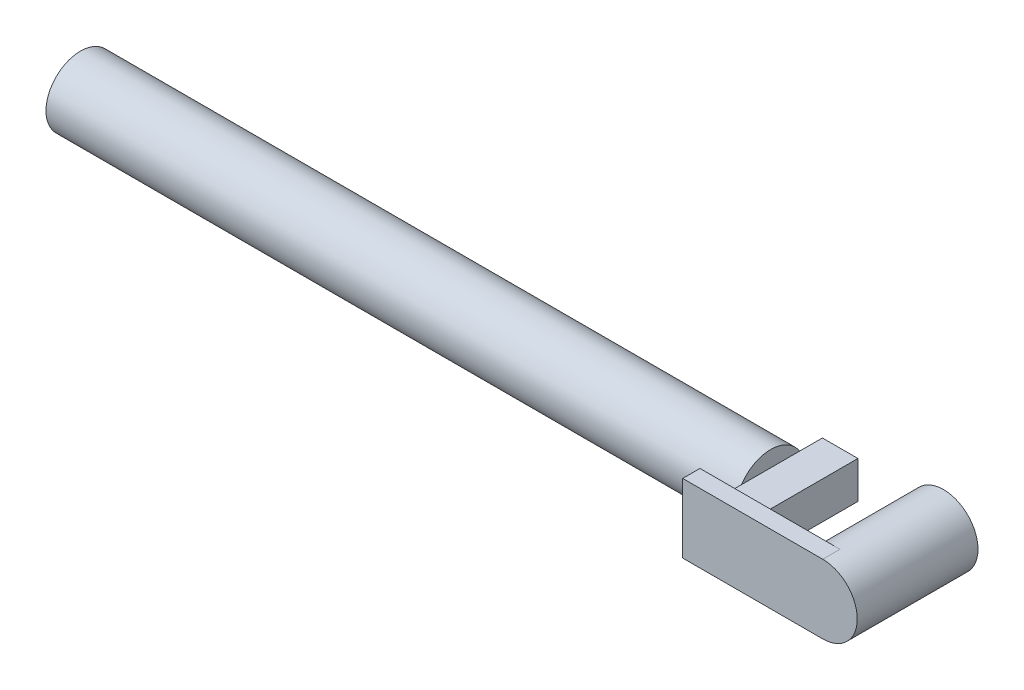
from build123d import *

# Parameters (mm, degrees)
SZKIC1_R                    = 10
DODANIE_WYCI_GNI_CIE1_DEPTH = 15
DODANIE_WYCI_GNI_CIE2_START = 5
DODANIE_WYCI_GNI_CIE2_DEPTH = 5
SZKIC3_W                    = 10.29571442
SZKIC3_H                    = 10.783406156
DODANIE_WYCI_GNI_CIE3_DEPTH = 30
SZKIC4_R                    = 10
DODANIE_WYCI_GNI_CIE4_DEPTH = 200


with BuildPart() as part:
    # Szkic1 → Dodanie-wyciągnięcie1 (new, symmetric)
    with BuildSketch(Plane.XY):
        Circle(SZKIC1_R)
    extrude(amount=DODANIE_WYCI_GNI_CIE1_DEPTH, both=True)

    # Szkic2 → Dodanie-wyciągnięcie2 (add)
    with BuildSketch(Plane.XY.offset(15).offset(DODANIE_WYCI_GNI_CIE2_START)):
        with BuildLine():
            Line((0, 10), (-40.57595794, 10))
            Line((-40.57595794, 10), (-40.57595794, -10))
            Line((-40.57595794, -10), (0, -10))
            ThreePointArc((0, -10), (10, 0), (0, 10))
        make_face()
    extrude(amount=-DODANIE_WYCI_GNI_CIE2_DEPTH)

    # Szkic3 → Dodanie-wyciągnięcie3 (add)
    with BuildSketch(Plane(origin=(0, 0, 15), x_dir=(-1, 0, 0), z_dir=(0, 0, -1))):
        with Locations((29.945825027, 0)):
            Rectangle(SZKIC3_W, SZKIC3_H)
    extrude(amount=DODANIE_WYCI_GNI_CIE3_DEPTH)

    # Szkic4 → Dodanie-wyciągnięcie4 (add)
    with BuildSketch(Plane.ZY.offset(35.093682237)):
        with Locations(Location((0, 0, 0), (0, 0, 147.37282405))):
            Circle(SZKIC4_R)
    extrude(amount=DODANIE_WYCI_GNI_CIE4_DEPTH)


solid = part.part
